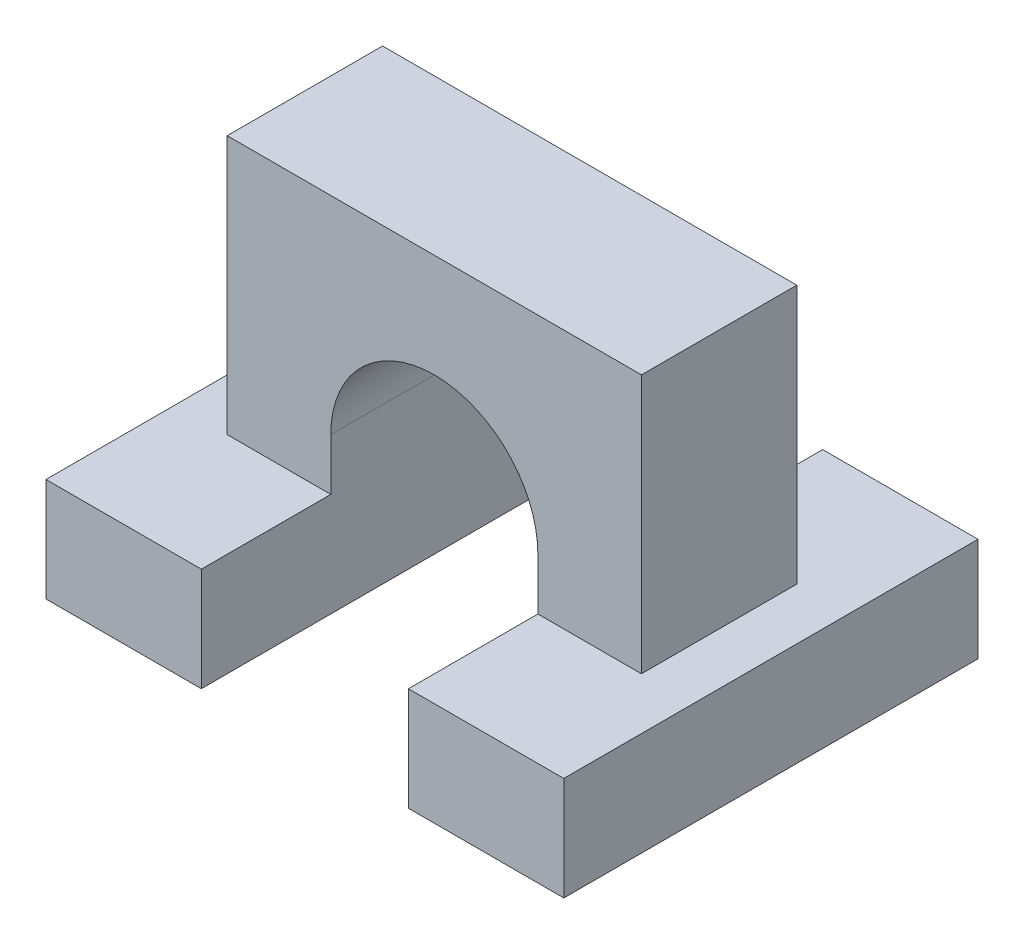
from build123d import *

# Parameters (mm, degrees)
BOSS_EXTRUDE1_DEPTH = 15000
SKETCH2_W           = 15000
SKETCH2_H           = 40000
BOSS_EXTRUDE2_DEPTH = 10000


with BuildPart() as part:
    # Sketch1 → Boss-Extrude1 (new body)
    with BuildSketch(Plane.XY):
        with BuildLine():
            Line((-10000, 0), (-10000, -5000))
            Line((-10000, -5000), (-20000, -5000))
            Line((-20000, -5000), (-20000, 20000))
            Line((-20000, 20000), (20000, 20000))
            Line((20000, 20000), (20000, -5000))
            Line((20000, -5000), (10000, -5000))
            Line((10000, -5000), (10000, 0))
            ThreePointArc((10000, 0), (0, 10000), (-10000, 0))
        make_face()
    extrude(amount=BOSS_EXTRUDE1_DEPTH)

    # Sketch2 → Boss-Extrude2 (add)
    with BuildSketch(Plane.XZ.offset(5000)):
        with Locations((17500, 7500)):
            Rectangle(SKETCH2_W, SKETCH2_H)
        with Locations((-17500, 7500)):
            Rectangle(SKETCH2_W, SKETCH2_H)
    extrude(amount=BOSS_EXTRUDE2_DEPTH)


solid = part.part
